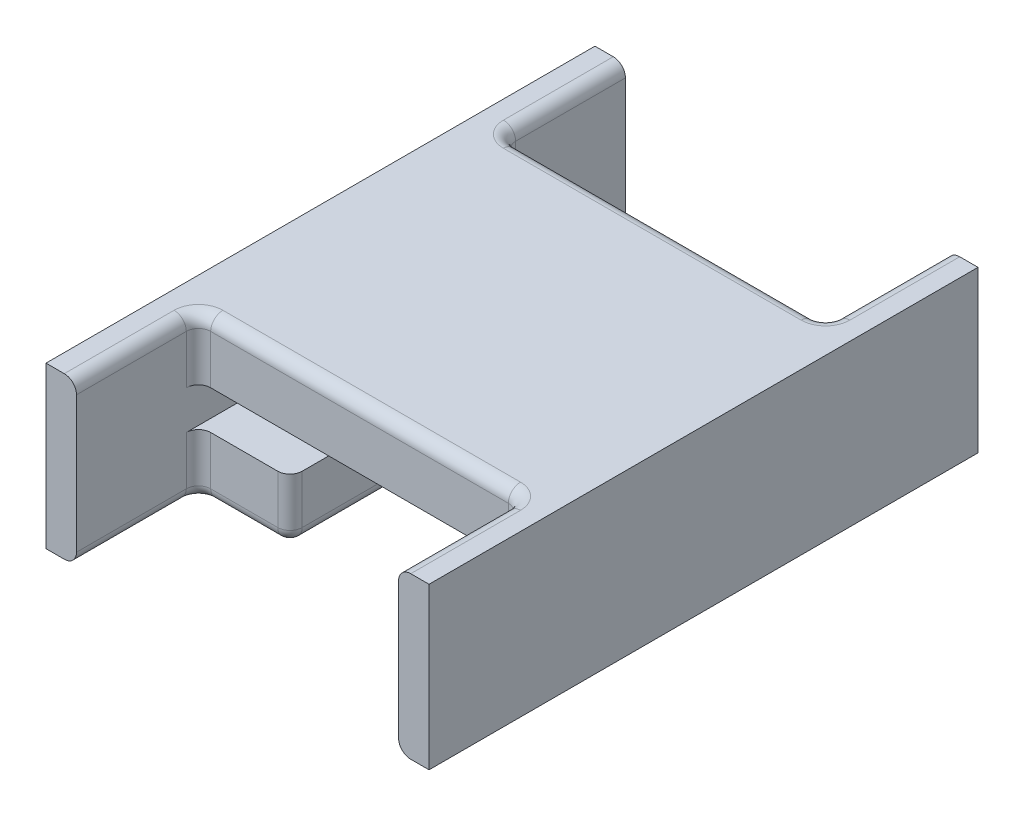
from build123d import *

# Parameters (mm, degrees)
BOSS_EXTRUDE1_DEPTH = 50
SKETCH2_W           = 5
SKETCH2_H           = 26.35
BOSS_EXTRUDE2_DEPTH = 20
SKETCH4_W           = 5
SKETCH4_H           = 26.35
BOSS_EXTRUDE3_DEPTH = 20
FILLET2_R           = 2


with BuildPart() as part:
    # Sketch1 → Boss-Extrude1 (new body)
    with BuildSketch(Plane.XY):
        Polygon((27.292868212, 8.549060403), (-35.507131788, 8.549060403), (-35.507131788, -17.800939597), (-15.507131788, -17.800939597), (-15.507131788, -7.800939597), (-30.507131788, -7.800939597), (-30.507131788, -1.450939597), (22.292868212, -1.450939597), (22.292868212, -7.800939597), (7.292868212, -7.800939597), (7.292868212, -17.800939597), (27.292868212, -17.800939597), align=None)
    extrude(amount=-BOSS_EXTRUDE1_DEPTH)

    # Sketch2 → Boss-Extrude2 (add)
    with BuildSketch(Plane.XY):
        with Locations((-33.007131788, -4.625939597)):
            Rectangle(SKETCH2_W, SKETCH2_H)
        with Locations((24.792868212, -4.625939597)):
            Rectangle(SKETCH2_W, SKETCH2_H)
    extrude(amount=BOSS_EXTRUDE2_DEPTH)

    # Sketch4 → Boss-Extrude3 (add)
    with BuildSketch(Plane(origin=(0, 0, -50), x_dir=(-1, 0, 0), z_dir=(0, 0, -1))):
        with Locations((-24.792868212, -4.625939597)):
            Rectangle(SKETCH4_W, SKETCH4_H)
        with Locations((33.007131788, -4.625939597)):
            Rectangle(SKETCH4_W, SKETCH4_H)
    extrude(amount=BOSS_EXTRUDE3_DEPTH)

    # Fillet2
    fillet2_edges = [part.edges().sort_by_distance(p)[0] for p in [
        (-15.507131788, -12.800939597, -50),
        (14.792868212, -17.800939597, 0),
        (7.292868212, -12.800939597, 0),
        (-15.507131788, -12.800939597, 0),
        (7.292868212, -17.800939597, -25),
        (-15.507131788, -17.800939597, -25),
        (-23.007131788, -17.800939597, 0),
        (-30.507131788, -12.800939597, 0),
        (7.292868212, -12.800939597, -50),
        (-30.507131788, 8.549060403, 10),
        (-30.507131788, -17.800939597, 10),
        (-30.507131788, 3.549060403, 0),
        (14.792868212, -17.800939597, -50),
        (-4.107131788, 8.549060403, 0),
        (22.292868212, 3.549060403, 0),
        (22.292868212, -12.800939597, 0),
        (22.292868212, 8.549060403, 10),
        (22.292868212, -17.800939597, 10),
        (-4.107131788, 8.549060403, -50),
        (22.292868212, 3.549060403, -50),
        (22.292868212, -12.800939597, -50),
        (22.292868212, -17.800939597, -60),
        (22.292868212, 8.549060403, -60),
        (-23.007131788, -17.800939597, -50),
        (-30.507131788, 3.549060403, -50),
        (-30.507131788, -12.800939597, -50),
        (-30.507131788, 8.549060403, -60),
        (-30.507131788, -17.800939597, -60),
    ]]
    fillet(fillet2_edges, radius=FILLET2_R)


solid = part.part
